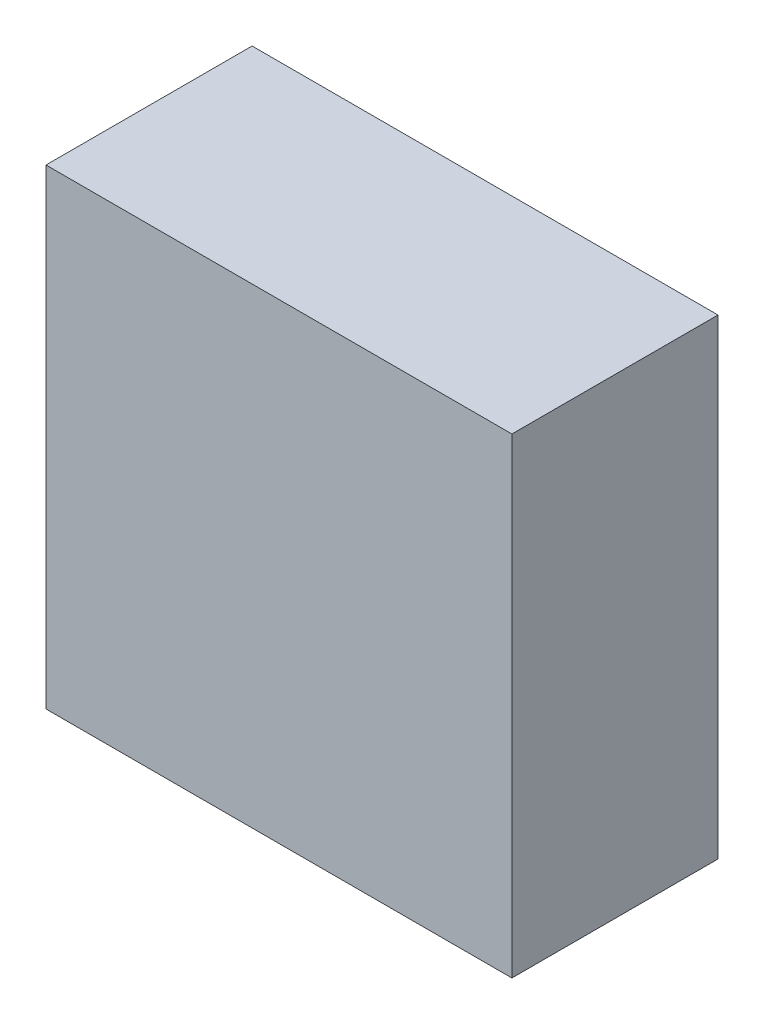
from build123d import *

# Parameters (mm, degrees)
SKETCH1_W               = 2.2606
SKETCH1_H               = 2.286
COMPONENT_OUTLINE_DEPTH = 1


with BuildPart() as part:
    # Sketch1 → Component_Outline (new body)
    with BuildSketch(Plane.XY):
        with Locations((1.1303, 1.143)):
            Rectangle(SKETCH1_W, SKETCH1_H)
    extrude(amount=COMPONENT_OUTLINE_DEPTH)


solid = part.part
